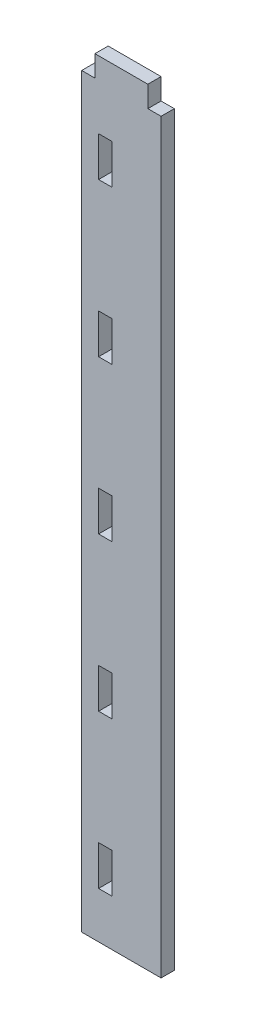
from build123d import *

# Parameters (mm, degrees)
ESQUISSE1_W             = 30
ESQUISSE1_H             = 290
BOSS_EXTRU_1_DEPTH      = 5
ESQUISSE1_6_W           = 5
ESQUISSE1_6_H           = 8
ENL_V_MAT_EXTRU_1_DEPTH = 5
ESQUISSE1_7_W           = 5
ESQUISSE1_7_H           = 15
ESQUISSE1_7_H_2         = 8
ENL_V_MAT_EXTRU_2_DEPTH = 5


with BuildPart() as part:
    # Esquisse1 → Boss.-Extru.1 (new body)
    with BuildSketch(Plane.XY):
        with Locations((-15, 145)):
            Rectangle(ESQUISSE1_W, ESQUISSE1_H)
    extrude(amount=BOSS_EXTRU_1_DEPTH)

    # Esquisse1<6> → Enlèv. mat.-Extru.1 (cut)
    with BuildSketch(Plane.XY):
        with Locations((-2.5, 286)):
            Rectangle(ESQUISSE1_6_W, ESQUISSE1_6_H)
    extrude(amount=ENL_V_MAT_EXTRU_1_DEPTH, mode=Mode.SUBTRACT)

    # Esquisse1<7> → Enlèv. mat.-Extru.2 (cut)
    with BuildSketch(Plane.XY):
        with Locations((-21.11, 25)):
            Rectangle(ESQUISSE1_7_W, ESQUISSE1_7_H)
        with Locations((-21.11, 83)):
            Rectangle(ESQUISSE1_7_W, ESQUISSE1_7_H)
        with Locations((-21.11, 141)):
            Rectangle(ESQUISSE1_7_W, ESQUISSE1_7_H)
        with Locations((-21.11, 199)):
            Rectangle(ESQUISSE1_7_W, ESQUISSE1_7_H)
        with Locations((-21.11, 257)):
            Rectangle(ESQUISSE1_7_W, ESQUISSE1_7_H)
        with Locations((-27.5, 286)):
            Rectangle(ESQUISSE1_7_W, ESQUISSE1_7_H_2)
    extrude(amount=ENL_V_MAT_EXTRU_2_DEPTH, mode=Mode.SUBTRACT)


solid = part.part
